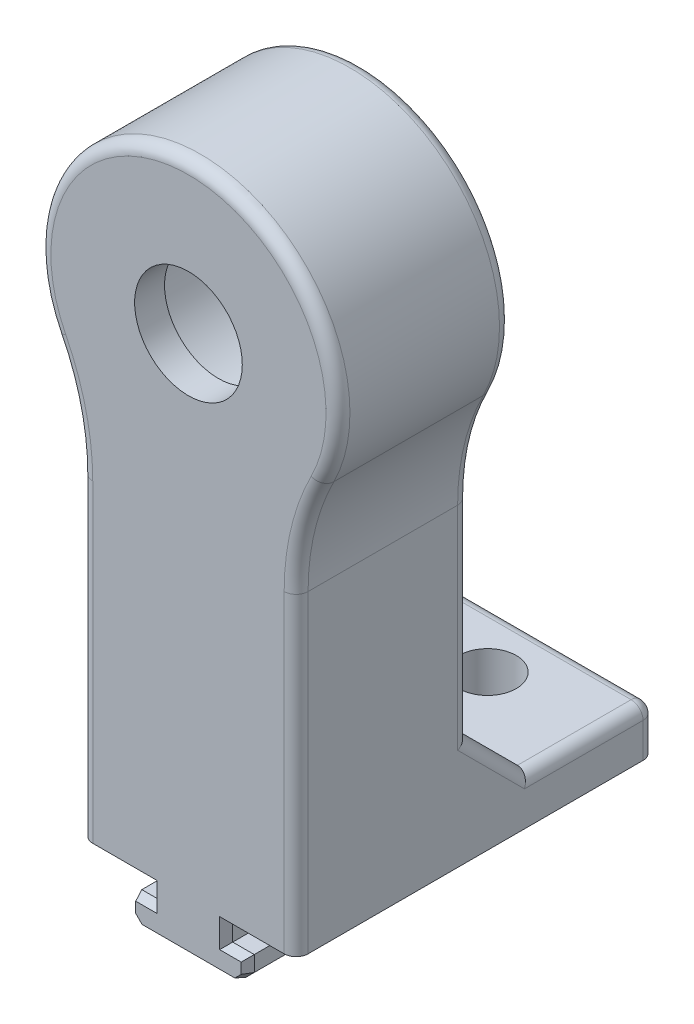
from build123d import *
from OCP.BRepFilletAPI import BRepFilletAPI_MakeChamfer

# Parameters (mm, degrees)
SKETCH_1_R          = 4.5
EXTRUDE_1_DEPTH     = 2.5
EXTRUDE_START       = -12
SKETCH_1_13_R       = 7.25
SKETCH_1_13_R_2     = 4.5
EXTRUDE_5_DEPTH     = 12
EXTRUDE_START_2     = -7.5
EXTRUDE_2_DEPTH     = 20
EXTRUDE_3_DEPTH     = 15.5
SKETCH_4_R          = 2.4
CUT_EXTRUDE_3_DEPTH = 58.989223137
CUT_EXTRUDE_5_DEPTH = 0.1
CHAMFER_3_SIZE      = 0.8
CHAMFER_3_SIZE2     = 0.291176187
CHAMFER_4_SIZE      = 5
FILLET_1_R          = 1


with BuildPart() as part:
    # 草图1 → 凸台-拉伸1 (new body)
    with BuildSketch(Plane.XY):
        with BuildLine():
            Line((2.9, 10), (9, 10))
            Line((9, 10), (9, 36.328599249))
            ThreePointArc((9, 36.328599249), (9.545912037, 40.969554058), (11.153846154, 45.357153557))
            ThreePointArc((11.153846154, 45.357153557), (0, 63.5), (-11.153846154, 45.357153557))
            ThreePointArc((-11.153846154, 45.357153557), (-9.545912037, 40.969554058), (-9, 36.328599249))
            Line((-9, 36.328599249), (-9, 10))
            Line((-9, 10), (-2.9, 10))
            Line((-2.9, 10), (-2.9, 8))
            Line((-2.9, 8), (-4.7, 8))
            Line((-4.7, 8), (-4.7, 6.7))
            Line((-4.7, 6.7), (-4, 6))
            Line((-4, 6), (4, 6))
            Line((4, 6), (4.7, 6.7))
            Line((4.7, 6.7), (4.7, 8))
            Line((4.7, 8), (2.9, 8))
            Line((2.9, 8), (2.9, 10))
        make_face()
        with Locations((0, 51)):
            Circle(SKETCH_1_R, mode=Mode.SUBTRACT)
    extrude(amount=EXTRUDE_1_DEPTH)

    # 草图1<13> → 凸台-拉伸5 (add)
    # profile 1 of 4: a face of its own
    with BuildSketch(Plane.XY.offset(EXTRUDE_START)):
        Polygon((2.9, 10), (9, 10), (9, 14), (-9, 14), (-9, 10), (-2.9, 10), align=None)
    # profile 2 of 4: a face of its own
    with BuildSketch(Plane.XY.offset(EXTRUDE_START)):
        Polygon((2.9, 8), (2.9, 10), (-2.9, 10), (-2.9, 8), (-4.7, 8), (-4.7, 6.7), (-4, 6), (4, 6), (4.7, 6.7), (4.7, 8), align=None)
    # profile 3 of 4: a face of its own
    with BuildSketch(Plane.XY.offset(EXTRUDE_START)):
        with BuildLine():
            Line((-9, 14), (9, 14))
            Line((9, 14), (9, 36.328599249))
            ThreePointArc((9, 36.328599249), (9.545912037, 40.969554058), (11.153846154, 45.357153557))
            ThreePointArc((11.153846154, 45.357153557), (0, 63.5), (-11.153846154, 45.357153557))
            ThreePointArc((-11.153846154, 45.357153557), (-9.545912037, 40.969554058), (-9, 36.328599249))
            Line((-9, 36.328599249), (-9, 14))
        make_face()
        with Locations((0, 51)):
            Circle(SKETCH_1_13_R, mode=Mode.SUBTRACT)
    # profile 4 of 4: a face of its own
    with BuildSketch(Plane.XY.offset(EXTRUDE_START)):
        with Locations((0, 51)):
            Circle(SKETCH_1_13_R_2)
    extrude(amount=EXTRUDE_5_DEPTH)


with BuildPart() as extrude_5_kept_piece:
    # of the separate pieces the step leaves, the one the design keeps (extrude_5_pieces_kept)
    add(part.part.solids().sort_by_distance((2.9, 10, 2.5))[0])

    # 草图1<10> → 凸台-拉伸2 (add)
    with BuildSketch(Plane.XY.offset(EXTRUDE_START_2)):
        Polygon((2.9, 10), (9, 10), (9, 14), (-9, 14), (-9, 10), (-2.9, 10), align=None)
    extrude(amount=-EXTRUDE_2_DEPTH)

    # 草图1<11> → 凸台-拉伸3 (add)
    with BuildSketch(Plane.XY):
        Polygon((2.9, 8), (4.7, 8), (4.7, 6.7), (4, 6), (-4, 6), (-4.7, 6.7), (-4.7, 8), (-2.9, 8), (-2.9, 10), (2.9, 10), align=None)
    extrude(amount=-EXTRUDE_3_DEPTH)

    # 草图4 → 切除-拉伸3 (cut, through all)
    with BuildSketch(Plane(origin=(0, 14, 0), x_dir=(1, 0, 0), z_dir=(0, 1, 0))):
        with Locations(Location((0, 22.5, 0), (0, 0, 270))):
            Circle(SKETCH_4_R)
    extrude(amount=-CUT_EXTRUDE_3_DEPTH, mode=Mode.SUBTRACT)

    # 草图7 → 切除-拉伸5 (cut)
    with BuildSketch(Plane.XZ.offset(-10)):
        Polygon((2.9, 2.5), (9, 2.5), (9, -27.5), (-9, -27.5), (-9, 2.5), (-2.9, 2.5), (-2.9, -15.5), (2.9, -15.5), align=None)
    extrude(amount=-CUT_EXTRUDE_5_DEPTH, mode=Mode.SUBTRACT)

    # 倒角3: one chamfer whose edges measure the first distance from different faces: ONE call of the kernel's chamfer builder (chamfer() names one face for all edges)
    chamfer_3_edges_1 = [extrude_5_kept_piece.edges().sort_by_distance(p)[0] for p in [
        (2.9, 9.05, -15.5),
        (2.9, 9.05, 2.5),
    ]]
    chamfer_3_side_1 = [extrude_5_kept_piece.faces().sort_by_distance(p)[0] for p in [
        (2.9, 9.05, -6.5),
    ]]
    chamfer_3_edges_2 = [extrude_5_kept_piece.edges().sort_by_distance(p)[0] for p in [
        (4.7, 7.35, -15.5),
        (4.7, 7.35, 2.5),
    ]]
    chamfer_3_side_2 = [extrude_5_kept_piece.faces().sort_by_distance(p)[0] for p in [
        (4.7, 7.35, -6.5),
    ]]
    chamfer_3_edges_3 = [extrude_5_kept_piece.edges().sort_by_distance(p)[0] for p in [
        (4.35, 6.35, -15.5),
        (4.35, 6.35, 2.5),
    ]]
    chamfer_3_side_3 = [extrude_5_kept_piece.faces().sort_by_distance(p)[0] for p in [
        (4.35, 6.35, -6.5),
    ]]
    chamfer_3_edges_4 = [extrude_5_kept_piece.edges().sort_by_distance(p)[0] for p in [
        (3.8, 8, -15.5),
        (3.8, 8, 2.5),
    ]]
    chamfer_3_side_4 = [extrude_5_kept_piece.faces().sort_by_distance(p)[0] for p in [
        (3.8, 8, -6.5),
    ]]
    chamfer_3_edges_5 = [extrude_5_kept_piece.edges().sort_by_distance(p)[0] for p in [
        (0, 6, -15.5),
        (0, 6, 2.5),
    ]]
    chamfer_3_side_5 = [extrude_5_kept_piece.faces().sort_by_distance(p)[0] for p in [
        (0, 6, -6.5),
    ]]
    chamfer_3_edges_6 = [extrude_5_kept_piece.edges().sort_by_distance(p)[0] for p in [
        (-4.35, 6.35, -15.5),
        (-4.35, 6.35, 2.5),
    ]]
    chamfer_3_side_6 = [extrude_5_kept_piece.faces().sort_by_distance(p)[0] for p in [
        (-4.35, 6.35, -6.5),
    ]]
    chamfer_3_edges_7 = [extrude_5_kept_piece.edges().sort_by_distance(p)[0] for p in [
        (-4.7, 7.35, -15.5),
        (-4.7, 7.35, 2.5),
    ]]
    chamfer_3_side_7 = [extrude_5_kept_piece.faces().sort_by_distance(p)[0] for p in [
        (-4.7, 7.35, -6.5),
    ]]
    chamfer_3_edges_8 = [extrude_5_kept_piece.edges().sort_by_distance(p)[0] for p in [
        (-3.8, 8, -15.5),
        (-3.8, 8, 2.5),
    ]]
    chamfer_3_side_8 = [extrude_5_kept_piece.faces().sort_by_distance(p)[0] for p in [
        (-3.8, 8, -6.5),
    ]]
    chamfer_3_edges_9 = [extrude_5_kept_piece.edges().sort_by_distance(p)[0] for p in [
        (-2.9, 9.05, -15.5),
        (-2.9, 9.05, 2.5),
    ]]
    chamfer_3_side_9 = [extrude_5_kept_piece.faces().sort_by_distance(p)[0] for p in [
        (-2.9, 9.05, -6.5),
    ]]
    chamfer_3 = BRepFilletAPI_MakeChamfer(extrude_5_kept_piece.part.solid().wrapped)
    for e in chamfer_3_edges_1:
        chamfer_3.Add(CHAMFER_3_SIZE, CHAMFER_3_SIZE2, e.wrapped, chamfer_3_side_1[0].wrapped)  # the first distance lies on this face
    for e in chamfer_3_edges_2:
        chamfer_3.Add(CHAMFER_3_SIZE, CHAMFER_3_SIZE2, e.wrapped, chamfer_3_side_2[0].wrapped)  # the first distance lies on this face
    for e in chamfer_3_edges_3:
        chamfer_3.Add(CHAMFER_3_SIZE, CHAMFER_3_SIZE2, e.wrapped, chamfer_3_side_3[0].wrapped)  # the first distance lies on this face
    for e in chamfer_3_edges_4:
        chamfer_3.Add(CHAMFER_3_SIZE, CHAMFER_3_SIZE2, e.wrapped, chamfer_3_side_4[0].wrapped)  # the first distance lies on this face
    for e in chamfer_3_edges_5:
        chamfer_3.Add(CHAMFER_3_SIZE, CHAMFER_3_SIZE2, e.wrapped, chamfer_3_side_5[0].wrapped)  # the first distance lies on this face
    for e in chamfer_3_edges_6:
        chamfer_3.Add(CHAMFER_3_SIZE, CHAMFER_3_SIZE2, e.wrapped, chamfer_3_side_6[0].wrapped)  # the first distance lies on this face
    for e in chamfer_3_edges_7:
        chamfer_3.Add(CHAMFER_3_SIZE, CHAMFER_3_SIZE2, e.wrapped, chamfer_3_side_7[0].wrapped)  # the first distance lies on this face
    for e in chamfer_3_edges_8:
        chamfer_3.Add(CHAMFER_3_SIZE, CHAMFER_3_SIZE2, e.wrapped, chamfer_3_side_8[0].wrapped)  # the first distance lies on this face
    for e in chamfer_3_edges_9:
        chamfer_3.Add(CHAMFER_3_SIZE, CHAMFER_3_SIZE2, e.wrapped, chamfer_3_side_9[0].wrapped)  # the first distance lies on this face
    add(Compound.cast(chamfer_3.Shape()), mode=Mode.REPLACE)

    # 倒角4
    chamfer_4_edges = [extrude_5_kept_piece.edges().sort_by_distance(p)[0] for p in [
        (0, 14, -12),
    ]]
    chamfer(chamfer_4_edges, length=CHAMFER_4_SIZE)

    # 圆角1
    fillet_1_edges = [extrude_5_kept_piece.edges().sort_by_distance(p)[0] for p in [
        (-9, 14, -22.25),
        (9, 14, -22.25),
        (0, 14, -27.5),
        (-9, 12.05, -27.5),
        (9, 12.05, -27.5),
        (9, 23.214299624, 2.5),
        (-9, 23.214299624, 2.5),
        (9.545912037, 40.969554058, 2.5),
        (0, 63.5, 2.5),
        (-9, 27.664299624, -12),
        (9, 27.664299624, -12),
        (9, 16.5, -14.5),
        (-9, 16.5, -14.5),
        (-9.545912037, 40.969554058, 2.5),
        (0, 63.5, -12),
        (9.545912037, 40.969554058, -12),
        (-9.545912037, 40.969554058, -12),
    ]]
    fillet(fillet_1_edges, radius=FILLET_1_R)


solid = extrude_5_kept_piece.part
